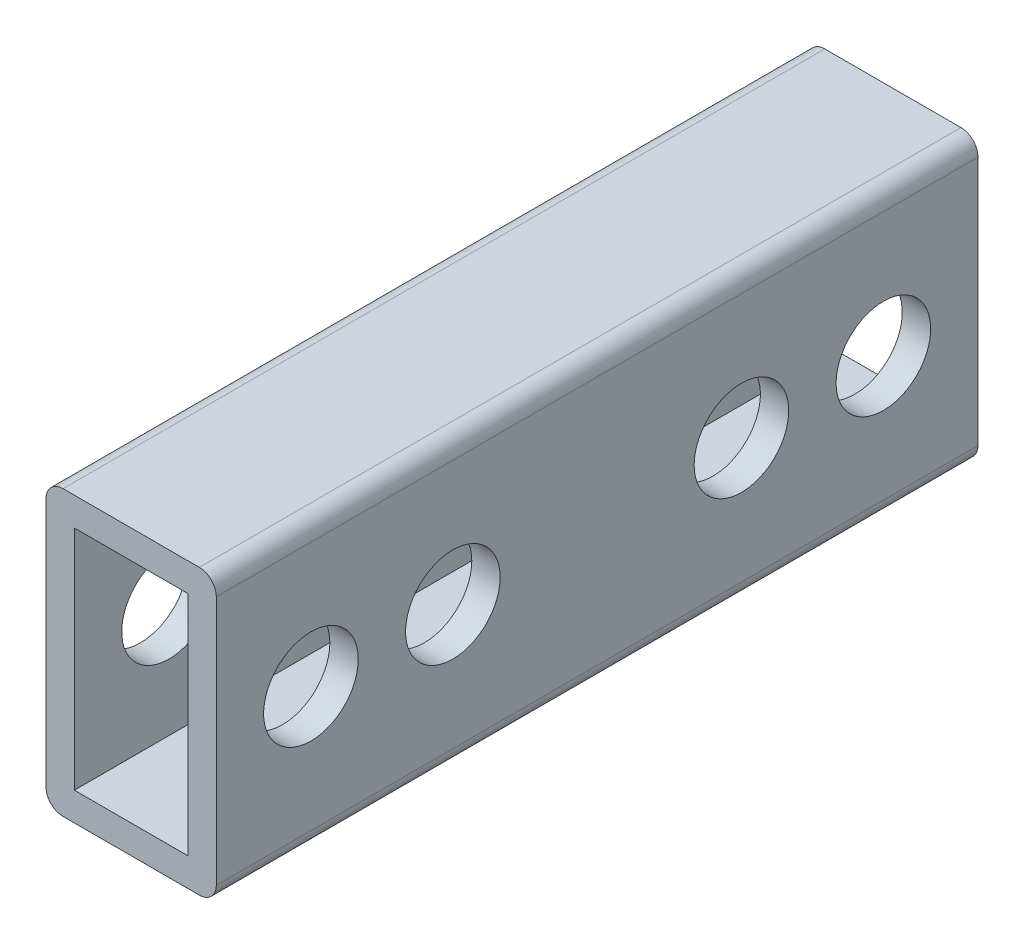
from build123d import *

# Parameters (mm, degrees)
SKETCH1_W         = 18
SKETCH1_H         = 30
SKETCH1_W_2       = 12
SKETCH1_H_2       = 24
BODY_DEPTH        = 80.5
SKETCH2_R         = 5
MOUNT_HOLES_DEPTH = 84.840622612
CORNER_FILLETS_R  = 1.8


with BuildPart() as part:
    # Sketch1 → Body (new body)
    with BuildSketch(Plane.XY):
        Rectangle(SKETCH1_W, SKETCH1_H)
        Rectangle(SKETCH1_W_2, SKETCH1_H_2, mode=Mode.SUBTRACT)
    extrude(amount=BODY_DEPTH)

    # Sketch2 → Mount Holes (cut, through all)
    with BuildSketch(Plane(origin=(9, 0, 0), x_dir=(0, 0, -1), z_dir=(1, 0, 0))):
        with Locations((-70.5, 0)):
            Circle(SKETCH2_R)
        with Locations((-55.5, 0)):
            Circle(SKETCH2_R)
        with Locations(Location((-25, 0, 0), (0, 0, 180))):
            Circle(SKETCH2_R)
        with Locations(Location((-10, 0, 0), (0, 0, 180))):
            Circle(SKETCH2_R)
    extrude(amount=-MOUNT_HOLES_DEPTH, mode=Mode.SUBTRACT)

    # Corner Fillets
    corner_fillets_edges = [part.edges().sort_by_distance(p)[0] for p in [
        (-9, 15, 40.25),
        (9, 15, 40.25),
        (9, -15, 40.25),
        (-9, -15, 40.25),
    ]]
    fillet(corner_fillets_edges, radius=CORNER_FILLETS_R)


solid = part.part
